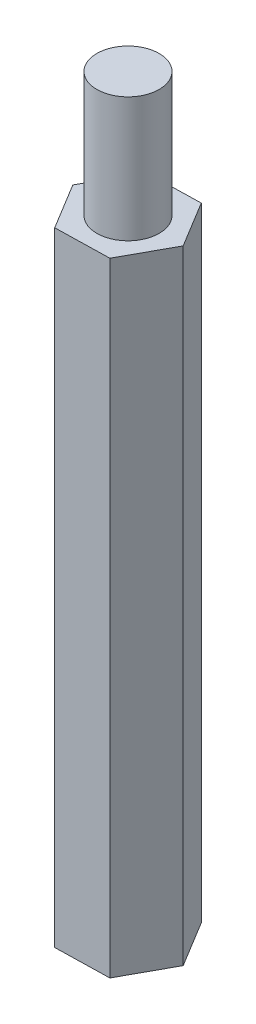
from build123d import *

# Parameters (mm, degrees)
SKETCH_1_R          = 1.5
EXTRUDE_1_DEPTH     = 30
SKETCH_1_2_R        = 1.5
EXTRUDE_2_DEPTH     = 36
SKETCH_2_R          = 1.5
CUT_EXTRUDE_1_DEPTH = 8


with BuildPart() as part:
    # 草图1 → 凸台-拉伸1 (new body)
    with BuildSketch(Plane(origin=(0, 0, 0), x_dir=(1, 0, 0), z_dir=(0, 1, 0))):
        Polygon((1.248465648, 2.278449808), (-1.348962591, 2.220427871), (-2.597428239, -0.058021937), (-1.248465648, -2.278449808), (1.348962591, -2.220427871), (2.597428239, 0.058021937), align=None)
        Circle(SKETCH_1_R, mode=Mode.SUBTRACT)
    extrude(amount=EXTRUDE_1_DEPTH)

    # 草图1<2> → 凸台-拉伸2 (add)
    with BuildSketch(Plane(origin=(0, 0, 0), x_dir=(1, 0, 0), z_dir=(0, 1, 0))):
        Circle(SKETCH_1_2_R)
    extrude(amount=EXTRUDE_2_DEPTH)

    # 草图2 → 切除-拉伸1 (cut)
    with BuildSketch(Plane.XZ):
        Circle(SKETCH_2_R)
    extrude(amount=-CUT_EXTRUDE_1_DEPTH, mode=Mode.SUBTRACT)


solid = part.part
